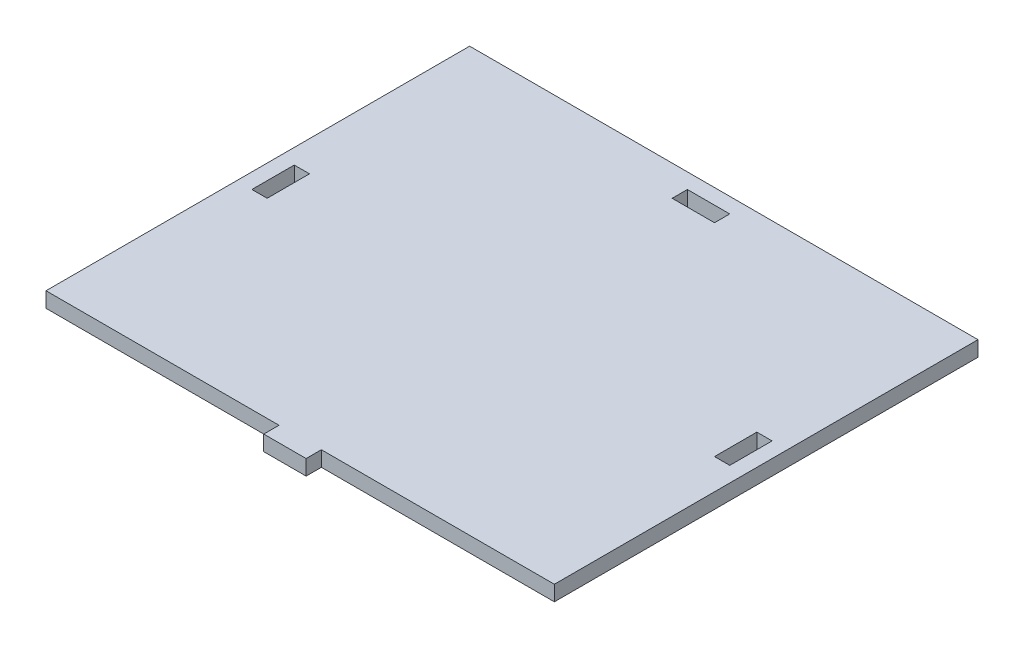
from build123d import *

# Parameters (mm, degrees)
SKETCH1_W           = 18
SKETCH1_H           = 50
SKETCH1_W_2         = 50
SKETCH1_H_2         = 18
BOSS_EXTRUDE1_DEPTH = 18


with BuildPart() as part:
    # Sketch1 → Boss-Extrude1 (new body)
    with BuildSketch(Plane(origin=(0, 0, 0), x_dir=(1, 0, 0), z_dir=(0, 1, 0))):
        Polygon((-300, 250), (300, 250), (300, -250), (25, -250), (25, -268), (-25, -268), (-25, -250), (-300, -250), align=None)
        with Locations((-273, 0)):
            Rectangle(SKETCH1_W, SKETCH1_H, mode=Mode.SUBTRACT)
        with Locations((0, 223)):
            Rectangle(SKETCH1_W_2, SKETCH1_H_2, mode=Mode.SUBTRACT)
        with Locations((273, 0)):
            Rectangle(SKETCH1_W, SKETCH1_H, mode=Mode.SUBTRACT)
    extrude(amount=BOSS_EXTRUDE1_DEPTH)


solid = part.part
